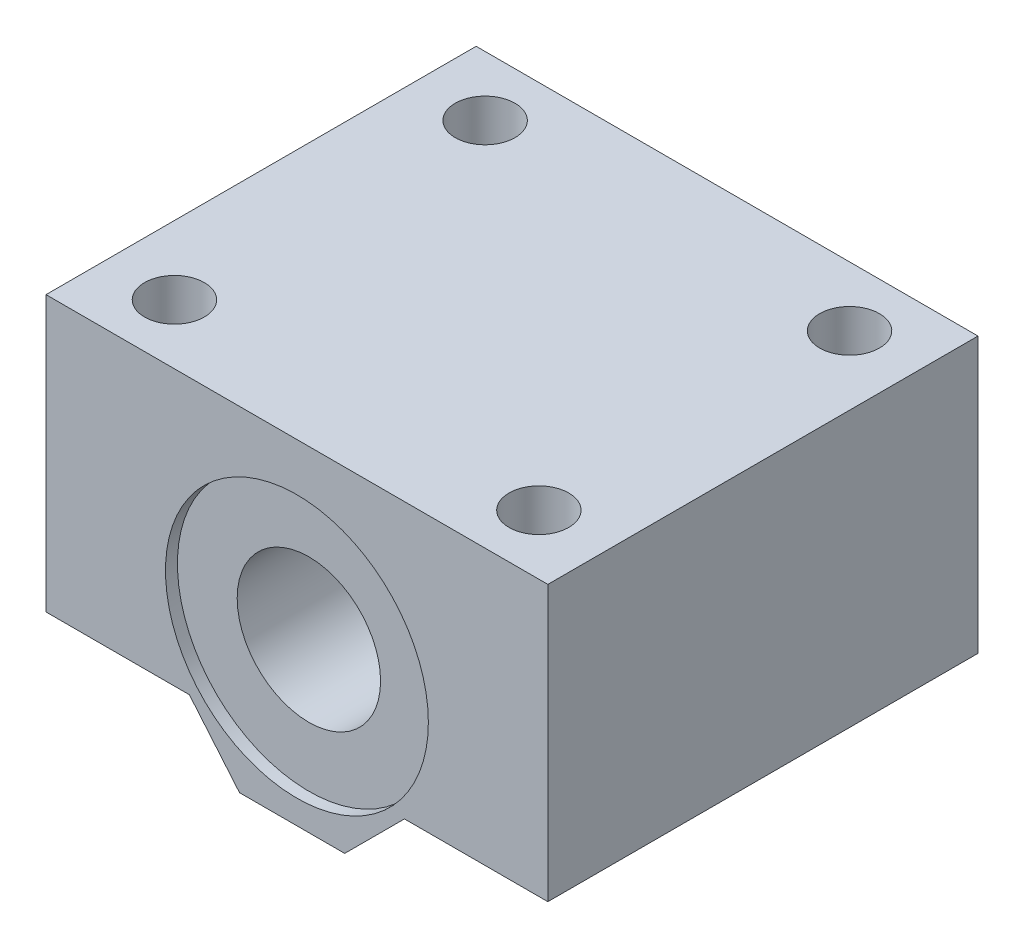
from build123d import *

# Parameters (mm, degrees)
SKETCH1_W           = 42
SKETCH1_H           = 28
SKETCH1_R           = 6
BOSS_EXTRUDE1_DEPTH = 18
CUT_EXTRUDE5_DEPTH  = 44.965895874
SKETCH2_R           = 2.15
CUT_EXTRUDE1_DEPTH  = 40.357337308
SKETCH3_R           = 2.5
CUT_EXTRUDE2_DEPTH  = 12
SKETCH4_R           = 11
CUT_EXTRUDE3_DEPTH  = 1
CUT_EXTRUDE4_START  = -1
SKETCH5_R           = 11
CUT_EXTRUDE4_DEPTH  = 1


with BuildPart() as part:
    # Sketch1 → Boss-Extrude1 (new, symmetric)
    with BuildSketch(Plane.XY):
        Rectangle(SKETCH1_W, SKETCH1_H)
        with Locations((0, -1)):
            Circle(SKETCH1_R, mode=Mode.SUBTRACT)
    extrude(amount=BOSS_EXTRUDE1_DEPTH, both=True)

    # Sketch6 → Cut-Extrude5 (cut, through all)
    with BuildSketch(Plane.XY.offset(18)):
        Polygon((-21, -9), (-9, -9), (-4.804501844, -14), (-21, -14), align=None)
        Polygon((21, -9), (9, -9), (4, -14), (21, -14), align=None)
    extrude(amount=-CUT_EXTRUDE5_DEPTH, mode=Mode.SUBTRACT)

    # Sketch2 → Cut-Extrude1 (cut, through all)
    with BuildSketch(Plane(origin=(0, 14, 0), x_dir=(-1, 0, 0), z_dir=(0, -1, 0))):
        with Locations(Location((15.25, -13, 0), (0, 0, 270))):
            Circle(SKETCH2_R)
        with Locations((-15.25, -13)):
            Circle(SKETCH2_R)
        with Locations((-15.25, 13)):
            Circle(SKETCH2_R)
        with Locations(Location((15.25, 13, 0), (0, 0, 270))):
            Circle(SKETCH2_R)
    extrude(amount=CUT_EXTRUDE1_DEPTH, mode=Mode.SUBTRACT)

    # Sketch3 → Cut-Extrude2 (cut)
    with BuildSketch(Plane.XZ.offset(-14)):
        with Locations(Location((-15.25, 13, 0), (0, 0, 270))):
            Circle(SKETCH3_R)
        with Locations(Location((15.25, 13, 0), (0, 0, 270))):
            Circle(SKETCH3_R)
        with Locations(Location((15.25, -13, 0), (0, 0, 270))):
            Circle(SKETCH3_R)
        with Locations(Location((-15.25, -13, 0), (0, 0, 270))):
            Circle(SKETCH3_R)
    extrude(amount=CUT_EXTRUDE2_DEPTH, mode=Mode.SUBTRACT)

    # Sketch4 → Cut-Extrude3 (cut)
    with BuildSketch(Plane.XY.offset(18)):
        with Locations((0, -1)):
            Circle(SKETCH4_R)
    extrude(amount=-CUT_EXTRUDE3_DEPTH, mode=Mode.SUBTRACT)

    # Sketch5 → Cut-Extrude4 (cut)
    with BuildSketch(Plane(origin=(0, 0, -18), x_dir=(-1, 0, 0), z_dir=(0, 0, -1)).offset(CUT_EXTRUDE4_START)):
        with Locations(Location((0, -1, 0), (0, 0, 180))):
            Circle(SKETCH5_R)
    extrude(amount=CUT_EXTRUDE4_DEPTH, mode=Mode.SUBTRACT)


solid = part.part
